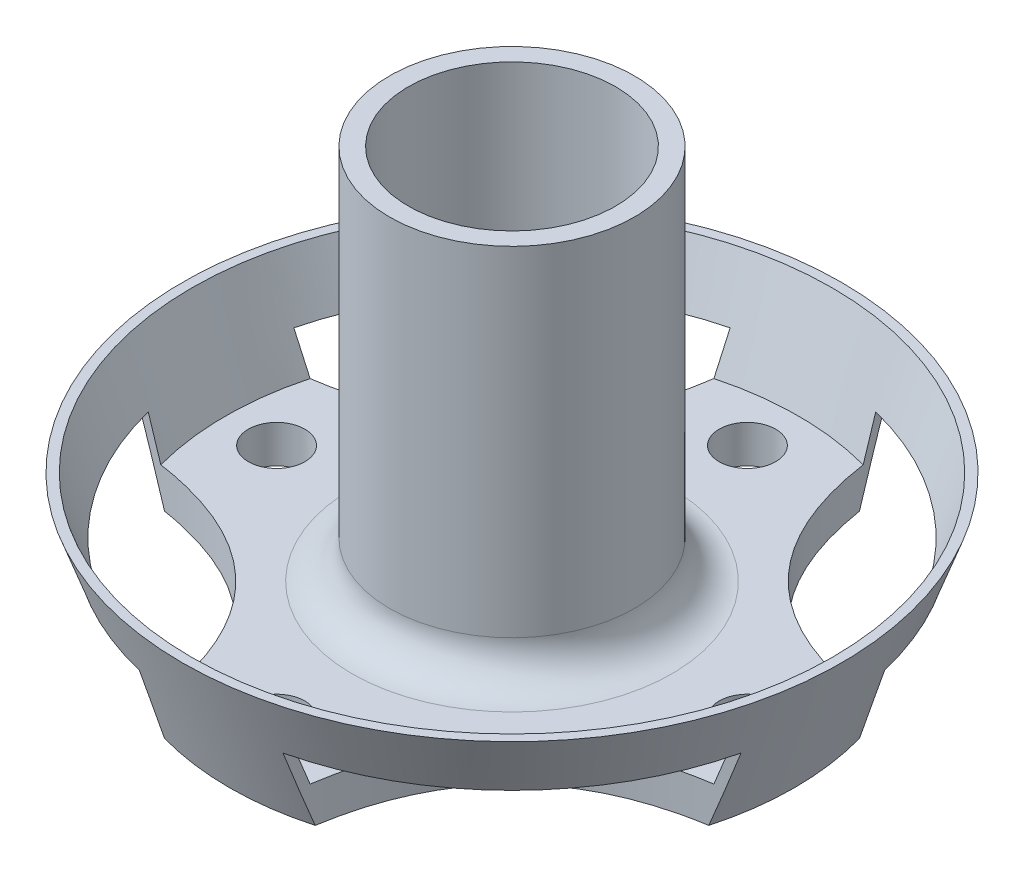
from build123d import *

# Parameters (mm, degrees)
SKETCH1_R           = 17.5
BOSS_EXTRUDE1_DEPTH = 7
BOSS_EXTRUDE1_DRAFT = -19.7
SKETCH5_R           = 17
CUT_EXTRUDE1_DEPTH  = 5
CUT_EXTRUDE1_DRAFT  = -19.7
CUT_EXTRUDE2_DEPTH  = 4
SKETCH7_R           = 5.5
CUT_EXTRUDE3_DEPTH  = 26.719642463
SKETCH8_R           = 1.5
CUT_EXTRUDE4_DEPTH  = 26.719642463
SKETCH9_R           = 6.5
BOSS_EXTRUDE2_DEPTH = 20
FILLET1_R           = 2
SKETCH10_R          = 5.5
CUT_EXTRUDE5_DEPTH  = 32.819805263


with BuildPart() as part:
    # Sketch1 → Boss-Extrude1 (with draft: the straight prism first)
    with BuildSketch(Plane(origin=(0, 0, 0), x_dir=(1, 0, 0), z_dir=(0, 1, 0))):
        Circle(SKETCH1_R)
    extrude(amount=-BOSS_EXTRUDE1_DEPTH)
    # Boss-Extrude1: the draft: its side faces are tilted about the plane it starts from
    boss_extrude1_sides = [part.faces().sort_by_distance(p)[0] for p in [
        (-17.5, -3.5, 0),
    ]]
    draft(boss_extrude1_sides, Plane(origin=(0, 0, 0), x_dir=(1, 0, 0), z_dir=(0, 1, 0)), BOSS_EXTRUDE1_DRAFT)


with BuildPart() as cut_extrude1_tool:
    # Sketch5 → Cut-Extrude1 (with draft: the straight prism first)
    with BuildSketch(Plane(origin=(0, 0, 0), x_dir=(1, 0, 0), z_dir=(0, 1, 0))):
        Circle(SKETCH5_R)
    extrude(amount=-CUT_EXTRUDE1_DEPTH)
    # Cut-Extrude1: the draft: its side faces are tilted about the plane it starts from
    cut_extrude1_sides = [cut_extrude1_tool.faces().sort_by_distance(p)[0] for p in [
        (-17, -2.5, 0),
    ]]
    draft(cut_extrude1_sides, Plane(origin=(0, 0, 0), x_dir=(1, 0, 0), z_dir=(0, 1, 0)), CUT_EXTRUDE1_DRAFT)


with BuildPart() as part_1:
    add(part.part)

    # Cut-Extrude1: cut by cut_extrude1_tool
    add(cut_extrude1_tool.part, mode=Mode.SUBTRACT)

    # Sketch6 → Cut-Extrude2 (cut)
    with BuildSketch(Plane.XZ.offset(7)):
        with BuildLine():
            add(Edge.make_bspline(
                [(-3.745787555, 17.094416503), (-3.800126667, 15.699556272), (-4, 14.450230262)],
                knots=[0, 0, 0, 0.108565408, 0.108565408, 0.108565408], degree=2))
            ThreePointArc((-3.745787555, 17.094416503), (-12.374368671, 12.374368671), (-17.094416503, 3.745787555))
            add(Edge.make_bspline(
                [(-14.450230262, 4), (-15.699556272, 3.800126667), (-17.094416503, 3.745787555)],
                knots=[0.891434592, 0.891434592, 0.891434592, 1, 1, 1], degree=2))
            ThreePointArc((-14.450230262, 4), (-10.602102495, 10.602102495), (-4, 14.450230262))
        make_face()
        with BuildLine():
            add(Edge.make_bspline(
                [(-4, 14.450230262), (-5.441294026, 5.441294026), (-14.450230262, 4)],
                knots=[0.108565408, 0.108565408, 0.108565408, 0.891434592, 0.891434592, 0.891434592], degree=2))
            ThreePointArc((-4, 14.450230262), (-10.602102495, 10.602102495), (-14.450230262, 4))
        make_face()
        with BuildLine():
            ThreePointArc((-17.094416503, -3.745787555), (-12.374368671, -12.374368671), (-3.745787555, -17.094416503))
            add(Edge.make_bspline(
                [(-3.745787555, -17.094416503), (-3.800126667, -15.699556272), (-4, -14.450230262)],
                knots=[0, 0, 0, 0.108565408, 0.108565408, 0.108565408], degree=2))
            ThreePointArc((-4, -14.450230262), (-10.602102495, -10.602102495), (-14.450230262, -4))
            add(Edge.make_bspline(
                [(-14.450230262, -4), (-15.699556272, -3.800126667), (-17.094416503, -3.745787555)],
                knots=[0.891434592, 0.891434592, 0.891434592, 1, 1, 1], degree=2))
        make_face()
        with BuildLine():
            ThreePointArc((-14.450230262, -4), (-10.602102495, -10.602102495), (-4, -14.450230262))
            add(Edge.make_bspline(
                [(-4, -14.450230262), (-5.441294026, -5.441294026), (-14.450230262, -4)],
                knots=[0.108565408, 0.108565408, 0.108565408, 0.891434592, 0.891434592, 0.891434592], degree=2))
        make_face()
        with BuildLine():
            ThreePointArc((4, -14.450230262), (10.602102495, -10.602102495), (14.450230262, -4))
            add(Edge.make_bspline(
                [(4, -14.450230262), (5.441294026, -5.441294026), (14.450230262, -4)],
                knots=[0.108565408, 0.108565408, 0.108565408, 0.891434592, 0.891434592, 0.891434592], degree=2))
        make_face()
        with BuildLine():
            ThreePointArc((3.745787555, -17.094416503), (12.374368671, -12.374368671), (17.094416503, -3.745787555))
            add(Edge.make_bspline(
                [(14.450230262, -4), (15.699556272, -3.800126667), (17.094416503, -3.745787555)],
                knots=[0.891434592, 0.891434592, 0.891434592, 1, 1, 1], degree=2))
            ThreePointArc((14.450230262, -4), (10.602102495, -10.602102495), (4, -14.450230262))
            add(Edge.make_bspline(
                [(3.745787555, -17.094416503), (3.800126667, -15.699556272), (4, -14.450230262)],
                knots=[0, 0, 0, 0.108565408, 0.108565408, 0.108565408], degree=2))
        make_face()
        with BuildLine():
            add(Edge.make_bspline(
                [(4, 14.450230262), (5.441294026, 5.441294026), (14.450230262, 4)],
                knots=[0.108565408, 0.108565408, 0.108565408, 0.891434592, 0.891434592, 0.891434592], degree=2))
            ThreePointArc((14.450230262, 4), (10.602102495, 10.602102495), (4, 14.450230262))
        make_face()
        with BuildLine():
            add(Edge.make_bspline(
                [(14.450230262, 4), (15.699556272, 3.800126667), (17.094416503, 3.745787555)],
                knots=[0.891434592, 0.891434592, 0.891434592, 1, 1, 1], degree=2))
            ThreePointArc((17.094416503, 3.745787555), (12.374368671, 12.374368671), (3.745787555, 17.094416503))
            add(Edge.make_bspline(
                [(3.745787555, 17.094416503), (3.800126667, 15.699556272), (4, 14.450230262)],
                knots=[0, 0, 0, 0.108565408, 0.108565408, 0.108565408], degree=2))
            ThreePointArc((4, 14.450230262), (10.602102495, 10.602102495), (14.450230262, 4))
        make_face()
    extrude(amount=-CUT_EXTRUDE2_DEPTH, mode=Mode.SUBTRACT)

    # Sketch7 → Cut-Extrude3 (cut, through all)
    with BuildSketch(Plane.XZ.offset(7)):
        with Locations(Location((0, 0, 0), (0, 0, 270))):
            Circle(SKETCH7_R)
    extrude(amount=-CUT_EXTRUDE3_DEPTH, mode=Mode.SUBTRACT)

    # Sketch8 → Cut-Extrude4 (cut, through all)
    with BuildSketch(Plane.XZ.offset(7)):
        with Locations(Location((-12.5, 0, 0), (0, 0, 270))):
            Circle(SKETCH8_R)
        with Locations(Location((0, 12.5, 0), (0, 0, 270))):
            Circle(SKETCH8_R)
        with Locations(Location((12.5, 0, 0), (0, 0, 270))):
            Circle(SKETCH8_R)
        with Locations(Location((0, -12.5, 0), (0, 0, 270))):
            Circle(SKETCH8_R)
    extrude(amount=-CUT_EXTRUDE4_DEPTH, mode=Mode.SUBTRACT)

    # Sketch9 → Boss-Extrude2 (add)
    with BuildSketch(Plane(origin=(0, -5, 0), x_dir=(1, 0, 0), z_dir=(0, 1, 0))):
        with Locations(Location((0, 0, 0), (0, 0, 270))):
            Circle(SKETCH9_R)
    extrude(amount=BOSS_EXTRUDE2_DEPTH)

    # Fillet1
    fillet1_edges = [part_1.edges().sort_by_distance(p)[0] for p in [
        (0, -5, -6.5),
    ]]
    fillet(fillet1_edges, radius=FILLET1_R)

    # Sketch10 → Cut-Extrude5 (cut, through all)
    with BuildSketch(Plane.XZ.offset(5)):
        with Locations(Location((0, 0, 0), (0, 0, 270))):
            Circle(SKETCH10_R)
    extrude(amount=-CUT_EXTRUDE5_DEPTH, mode=Mode.SUBTRACT)


solid = part_1.part
